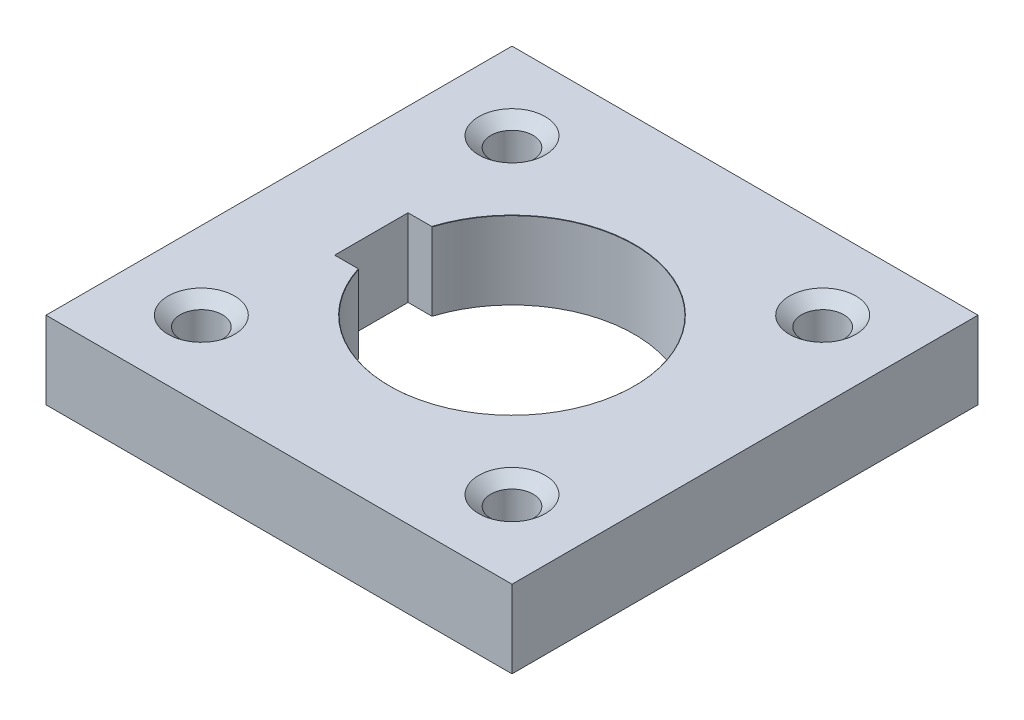
from build123d import *

# Parameters (mm, degrees)
SKETCH1_W                       = 38.1
SKETCH1_H                       = 38.1
BOSS_EXTRUDE1_DEPTH             = 6.35
F_8_32_TAPPED_HOLE1_D           = 3.4544
F_8_32_TAPPED_HOLE1_CSINK_D     = 5.4356
F_8_32_TAPPED_HOLE1_CSINK_ANGLE = 100
SKETCH6_W                       = 6
SKETCH6_H                       = 6
CUT_EXTRUDE1_DEPTH              = 55.254423783


with BuildPart() as part:
    # Sketch1 → Boss-Extrude1 (new body)
    with BuildSketch(Plane(origin=(0, 0, 0), x_dir=(1, 0, 0), z_dir=(0, 1, 0))):
        with Locations((19.05, 19.05)):
            Rectangle(SKETCH1_W, SKETCH1_H)
    extrude(amount=BOSS_EXTRUDE1_DEPTH)

    # #8-32 Tapped Hole1 (through all)
    with Locations(Plane(origin=(0, 6.35, 0), x_dir=(1, 0, 0), z_dir=(0, 1, 0))):
        with Locations((31.75, 31.75), (6.35, 31.75), (6.35, 6.35), (31.75, 6.35)):
            CounterSinkHole(F_8_32_TAPPED_HOLE1_D / 2, F_8_32_TAPPED_HOLE1_CSINK_D / 2, counter_sink_angle=F_8_32_TAPPED_HOLE1_CSINK_ANGLE)

    # Sketch5 → M18 Clearance Hole1 (revolve, cut)
    with BuildSketch(Plane(origin=(19.05, 6.35, -19.05), x_dir=(0, 0, 1), z_dir=(1, 0, 0))):
        Polygon((0, 0), (0, 6.35), (10, 6.35), (10, 0.020977491), (10.025, 0), align=None)
    revolve(axis=Axis((19.05, 12.7, -19.05), (0, -1, 0)), mode=Mode.SUBTRACT)

    # Sketch6 → Cut-Extrude1 (cut, through all)
    with BuildSketch(Plane(origin=(0, 6.35, 0), x_dir=(1, 0, 0), z_dir=(0, 1, 0))):
        with Locations((10.55, 19.05)):
            Rectangle(SKETCH6_W, SKETCH6_H)
    extrude(amount=-CUT_EXTRUDE1_DEPTH, mode=Mode.SUBTRACT)


solid = part.part
